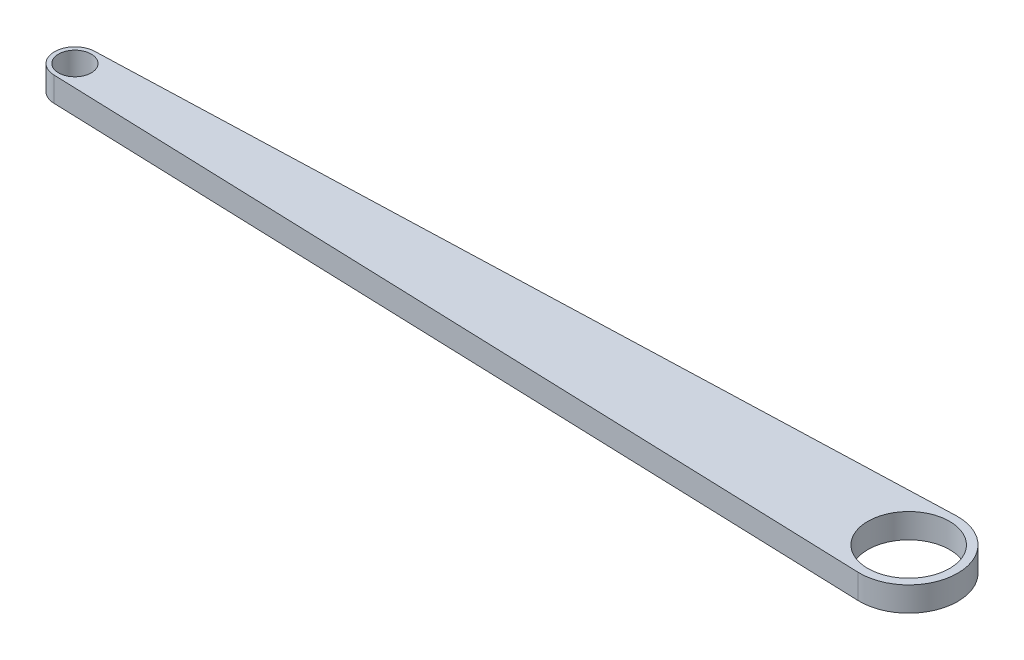
from build123d import *

# Parameters (mm, degrees)
BOSS_EXTRUDE1_DEPTH = 0.75
CUT_EXTRUDE1_REACH  = 54.358
SKETCH3_R           = 2.5
SKETCH3_R_2         = 1


with BuildPart() as part:
    # Sketch2 → Boss-Extrude1 (new, symmetric)
    with BuildSketch(Plane(origin=(0, 0, 0), x_dir=(1, 0, 0), z_dir=(0, 1, 0))):
        with BuildLine():
            Line((-51.042892157, 1.249263888), (-0.102941176, 2.998233332))
            ThreePointArc((-0.102941176, 2.998233332), (3, 0), (-0.102941176, -2.998233332))
            Line((-0.102941176, -2.998233332), (-51.042892157, -1.249263888))
            ThreePointArc((-51.042892157, -1.249263888), (-52.25, 0), (-51.042892157, 1.249263888))
        make_face()
    extrude(amount=BOSS_EXTRUDE1_DEPTH, both=True)

    # Sketch3 → Cut-Extrude1 (cut, up to next)
    with BuildSketch(Plane(origin=(0, 0.75, 0), x_dir=(1, 0, 0), z_dir=(0, 1, 0)), mode=Mode.PRIVATE) as cut_extrude1_sk1:
        with Locations(Location((0, 0, 0), (0, 0, 270))):
            Circle(SKETCH3_R)
    cut_extrude1_tool1 = extrude(cut_extrude1_sk1.sketch, amount=-CUT_EXTRUDE1_REACH, mode=Mode.PRIVATE) & part.part
    # Sketch3 → Cut-Extrude1 (cut, up to next)
    with BuildSketch(Plane(origin=(0, 0.75, 0), x_dir=(1, 0, 0), z_dir=(0, 1, 0)), mode=Mode.PRIVATE) as cut_extrude1_sk2:
        with Locations(Location((-51, 0, 0), (0, 0, 270))):
            Circle(SKETCH3_R_2)
    cut_extrude1_tool2 = extrude(cut_extrude1_sk2.sketch, amount=-CUT_EXTRUDE1_REACH, mode=Mode.PRIVATE) & part.part
    add(cut_extrude1_tool1.solids().sort_by_distance((0, 0.75, 0))[0], mode=Mode.SUBTRACT)
    add(cut_extrude1_tool2.solids().sort_by_distance((-51, 0.75, 0))[0], mode=Mode.SUBTRACT)


solid = part.part
